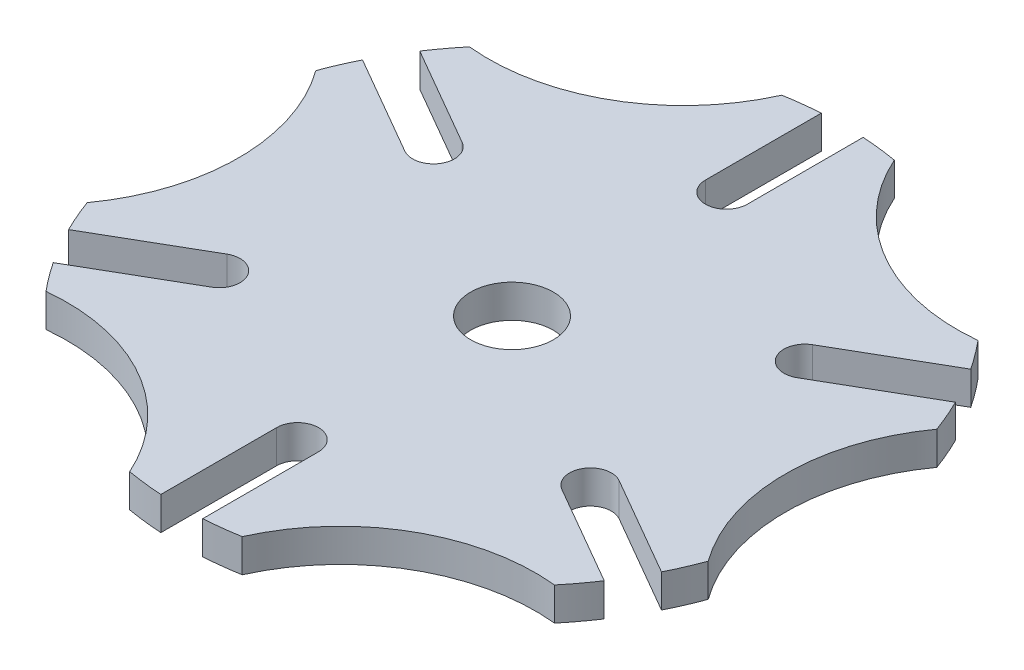
from build123d import *

# Parameters (mm, degrees)
SKETCH1_R           = 9.525
BOSS_EXTRUDE1_DEPTH = 7.62


with BuildPart() as part:
    # Sketch1 → Boss-Extrude1 (new body)
    with BuildSketch(Plane(origin=(0, 0, 0), x_dir=(1, 0, 0), z_dir=(0, 1, 0))):
        with BuildLine():
            Line((-4.826, 49.377023111), (-4.826, 76.047023111))
            ThreePointArc((-4.826, 76.047023111), (-8.902418576, 75.678180102), (-12.953151139, 75.090983983))
            ThreePointArc((-12.953151139, 75.090983983), (-31.496, 54.552672235), (-58.554124155, 48.763249937))
            ThreePointArc((-58.554124155, 48.763249937), (-61.088017192, 45.548810693), (-63.445653896, 42.202950154))
            Line((-63.445653896, 42.202950154), (-40.348756377, 28.867950154))
            ThreePointArc((-40.348756377, 28.867950154), (-38.582317778, 22.275511555), (-45.174756377, 20.509072957))
            Line((-45.174756377, 20.509072957), (-68.271653896, 33.844072957))
            ThreePointArc((-68.271653896, 33.844072957), (-69.990435768, 30.129369409), (-71.507275294, 26.327734046))
            ThreePointArc((-71.507275294, 26.327734046), (-62.992, 0), (-71.507275294, -26.327734046))
            ThreePointArc((-71.507275294, -26.327734046), (-69.990435768, -30.129369409), (-68.271653896, -33.844072957))
            Line((-68.271653896, -33.844072957), (-45.174756377, -20.509072957))
            ThreePointArc((-45.174756377, -20.509072957), (-38.582317778, -22.275511555), (-40.348756377, -28.867950154))
            Line((-40.348756377, -28.867950154), (-63.445653896, -42.202950154))
            ThreePointArc((-63.445653896, -42.202950154), (-61.088017192, -45.548810693), (-58.554124155, -48.763249937))
            ThreePointArc((-58.554124155, -48.763249937), (-31.496, -54.552672235), (-12.953151139, -75.090983983))
            ThreePointArc((-12.953151139, -75.090983983), (-8.902418576, -75.678180102), (-4.826, -76.047023111))
            Line((-4.826, -76.047023111), (-4.826, -49.377023111))
            ThreePointArc((-4.826, -49.377023111), (0, -44.551023111), (4.826, -49.377023111))
            Line((4.826, -49.377023111), (4.826, -76.047023111))
            ThreePointArc((4.826, -76.047023111), (8.902418576, -75.678180102), (12.953151139, -75.090983983))
            ThreePointArc((12.953151139, -75.090983983), (31.496, -54.552672235), (58.554124155, -48.763249937))
            ThreePointArc((58.554124155, -48.763249937), (61.088017192, -45.548810693), (63.445653896, -42.202950154))
            Line((63.445653896, -42.202950154), (40.348756377, -28.867950154))
            ThreePointArc((40.348756377, -28.867950154), (38.582317778, -22.275511555), (45.174756377, -20.509072957))
            Line((45.174756377, -20.509072957), (68.271653896, -33.844072957))
            ThreePointArc((68.271653896, -33.844072957), (69.990435768, -30.129369409), (71.507275294, -26.327734046))
            ThreePointArc((71.507275294, -26.327734046), (62.992, 0), (71.507275294, 26.327734046))
            ThreePointArc((71.507275294, 26.327734046), (69.990435768, 30.129369409), (68.271653896, 33.844072957))
            Line((68.271653896, 33.844072957), (45.174756377, 20.509072957))
            ThreePointArc((45.174756377, 20.509072957), (38.582317778, 22.275511555), (40.348756377, 28.867950154))
            Line((40.348756377, 28.867950154), (63.445653896, 42.202950154))
            ThreePointArc((63.445653896, 42.202950154), (61.088017192, 45.548810693), (58.554124155, 48.763249937))
            ThreePointArc((58.554124155, 48.763249937), (31.496, 54.552672235), (12.953151139, 75.090983983))
            ThreePointArc((12.953151139, 75.090983983), (8.902418576, 75.678180102), (4.826, 76.047023111))
            Line((4.826, 76.047023111), (4.826, 49.377023111))
            ThreePointArc((4.826, 49.377023111), (0, 44.551023111), (-4.826, 49.377023111))
        make_face()
        with Locations(Location((0, 0, 0), (0, 0, 90))):
            Circle(SKETCH1_R, mode=Mode.SUBTRACT)
    extrude(amount=BOSS_EXTRUDE1_DEPTH)


solid = part.part
